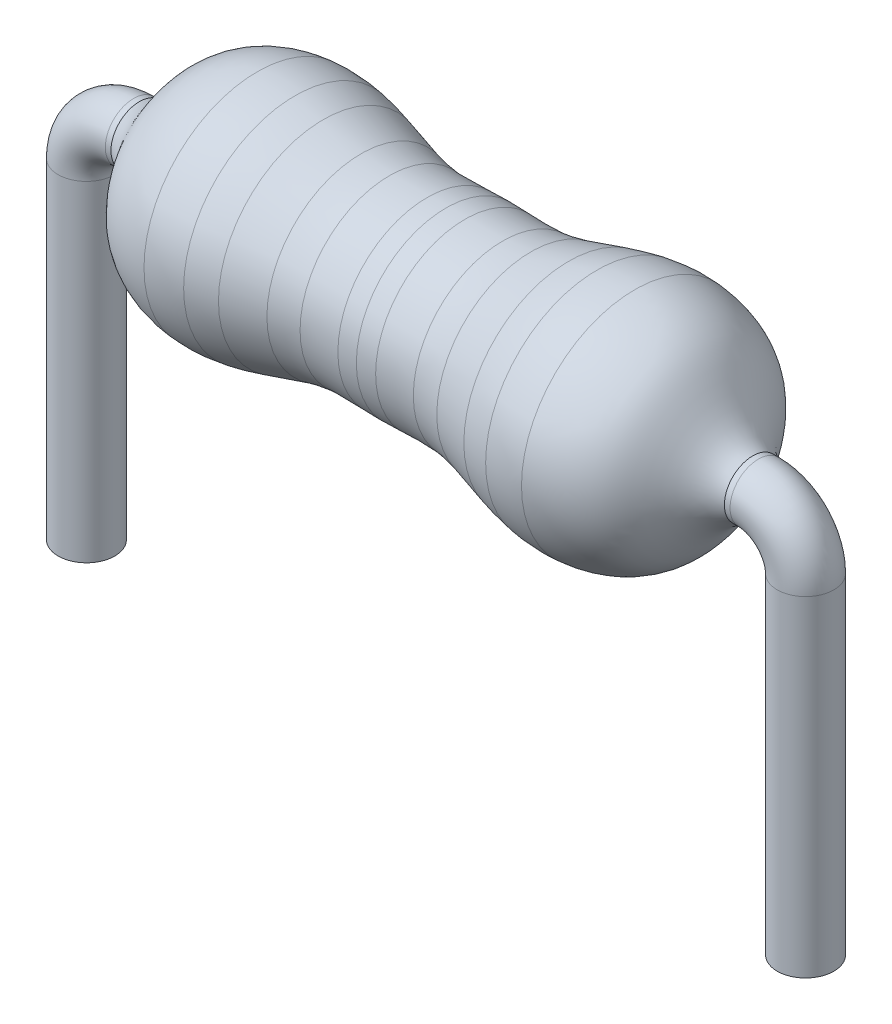
from build123d import *

# Parameters (mm, degrees)
SKETCH_5_R = 0.3


with BuildPart() as part:
    # Эскиз3 → Повернуть2 (revolve)
    with BuildSketch(Plane.XY):
        with BuildLine():
            Line((0, 0), (-3.25, 0))
            Line((-3.25, 0), (-3.25, 0.3))
            add(Edge.make_bspline(
                [(-2.000000082, 1.199999952), (-2.23604302, 1.181615986), (-2.789263679, 1.00505202), (-2.971144892, 0.430097598), (-3.25, 0.3)],
                knots=[0.780397484, 0.780397484, 0.780397484, 0.780397484, 0.876745066, 1, 1, 1, 1], degree=3))
            add(Edge.make_bspline(
                [(-1.6, 1.180025241), (-1.731399218, 1.201650855), (-1.864601443, 1.21054538), (-2.000000082, 1.199999952)],
                knots=[0.725130753, 0.725130753, 0.725130753, 0.725130753, 0.780397484, 0.780397484, 0.780397484, 0.780397484], degree=3))
            add(Edge.make_bspline(
                [(-1.3, 1.111050082), (-1.34982276, 1.125028982), (-1.449295193, 1.15139314), (-1.549743584, 1.171754066), (-1.6, 1.180025241)],
                knots=[0.682659096, 0.682659096, 0.682659096, 0.682659096, 0.70399282, 0.725130753, 0.725130753, 0.725130753, 0.725130753], degree=3))
            add(Edge.make_bspline(
                [(-0.9, 0.997661651), (-1.033638838, 1.030728014), (-1.166305516, 1.073539075), (-1.3, 1.111050082)],
                knots=[0.62541214, 0.62541214, 0.62541214, 0.62541214, 0.682659096, 0.682659096, 0.682659096, 0.682659096], degree=3))
            add(Edge.make_bspline(
                [(-0.6, 0.946228082), (-0.616698211, 0.947554212), (-0.71755748, 0.957111909), (-0.817198443, 0.977173996), (-0.9, 0.997661651)],
                knots=[0.582920397, 0.582920397, 0.582920397, 0.582920397, 0.589942383, 0.62541214, 0.62541214, 0.62541214, 0.62541214], degree=3))
            add(Edge.make_bspline(
                [(-0.2, 0.945686937), (-0.334396136, 0.941079864), (-0.468154451, 0.935757238), (-0.6, 0.946228082)],
                knots=[0.527476276, 0.527476276, 0.527476276, 0.527476276, 0.582920397, 0.582920397, 0.582920397, 0.582920397], degree=3))
            add(Edge.make_bspline(
                [(0, 0.95), (-0.066719861, 0.950074874), (-0.133438155, 0.947968664), (-0.2, 0.945686937)],
                knots=[0.500016684, 0.500016684, 0.500016684, 0.500016684, 0.527476276, 0.527476276, 0.527476276, 0.527476276], degree=3))
            add(Edge.make_bspline(
                [(0, 0.95), (0.066719861, 0.950074874), (0.133438155, 0.947968664), (0.2, 0.945686937)],
                knots=[0.500016684, 0.500016684, 0.500016684, 0.500016684, 0.527476276, 0.527476276, 0.527476276, 0.527476276], degree=3))
            add(Edge.make_bspline(
                [(0.2, 0.945686937), (0.334396136, 0.941079864), (0.468154451, 0.935757238), (0.6, 0.946228082)],
                knots=[0.527476276, 0.527476276, 0.527476276, 0.527476276, 0.582920397, 0.582920397, 0.582920397, 0.582920397], degree=3))
            add(Edge.make_bspline(
                [(0.6, 0.946228082), (0.616698211, 0.947554212), (0.71755748, 0.957111909), (0.817198443, 0.977173996), (0.9, 0.997661651)],
                knots=[0.582920397, 0.582920397, 0.582920397, 0.582920397, 0.589942383, 0.62541214, 0.62541214, 0.62541214, 0.62541214], degree=3))
            add(Edge.make_bspline(
                [(0.9, 0.997661651), (1.033638838, 1.030728014), (1.166305516, 1.073539075), (1.3, 1.111050082)],
                knots=[0.62541214, 0.62541214, 0.62541214, 0.62541214, 0.682659096, 0.682659096, 0.682659096, 0.682659096], degree=3))
            add(Edge.make_bspline(
                [(1.3, 1.111050082), (1.34982276, 1.125028982), (1.449295193, 1.15139314), (1.549743584, 1.171754066), (1.6, 1.180025241)],
                knots=[0.682659096, 0.682659096, 0.682659096, 0.682659096, 0.70399282, 0.725130753, 0.725130753, 0.725130753, 0.725130753], degree=3))
            add(Edge.make_bspline(
                [(1.6, 1.180025241), (1.731399218, 1.201650855), (1.864601443, 1.21054538), (2, 1.2)],
                knots=[0.725130753, 0.725130753, 0.725130753, 0.725130753, 0.780397484, 0.780397484, 0.780397484, 0.780397484], degree=3))
            add(Edge.make_bspline(
                [(2, 1.2), (2.23604302, 1.181615986), (2.789263679, 1.00505202), (2.971144892, 0.430097598), (3.25, 0.3)],
                knots=[0.780397484, 0.780397484, 0.780397484, 0.780397484, 0.876745066, 1, 1, 1, 1], degree=3))
            Line((3.25, 0.3), (3.25, 0))
            Line((3.25, 0), (0, 0))
        make_face()
    revolve(axis=Axis((0, 0, 0), (1, 0, 0)))

    # По траектории2: sweep along a path in Эскиз4
    with BuildLine(Plane.XY) as sweep_2_path:
        Line((2.987274619, 0), (3.31, 0))
        ThreePointArc((3.31, 0), (3.663553391, -0.146446609), (3.81, -0.5))
        Line((3.81, -0.5), (3.81, -4))
    # Эскиз5 → По траектории2 (sweep)
    with BuildSketch(Plane(origin=(0, -4, 0), x_dir=(1, 0, 0), z_dir=(0, 1, 0))):
        with Locations((3.81, 0)):
            Circle(SKETCH_5_R)
    sweep_2 = sweep(path=sweep_2_path.line)

    # Зеркальное отражение1: По траектории2 across plane
    add(sweep_2.mirror(Plane(origin=(0, 0, 0), x_dir=(0, 0, 1), z_dir=(1, 0, 0))))


solid = part.part
